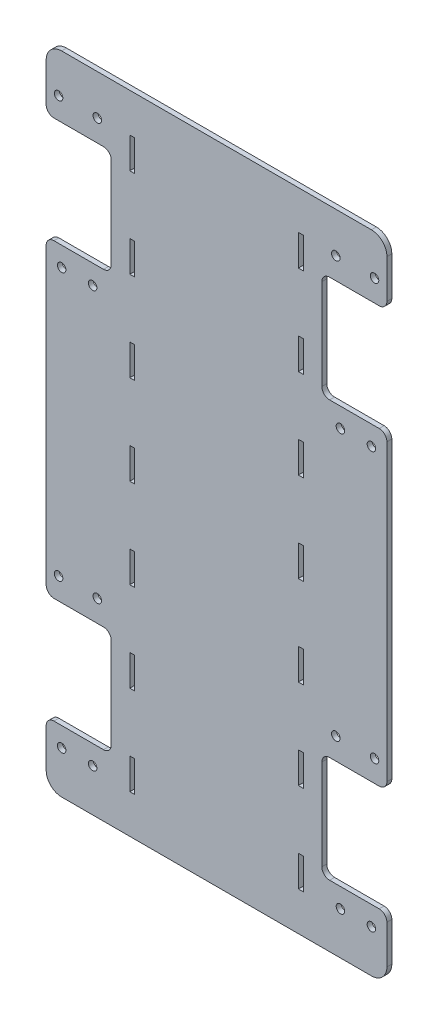
from build123d import *

# Parameters (mm, degrees)
BOSS_EXTRU_1_DEPTH      = 3.175
ESQUISSE2_W             = 3.175
ESQUISSE2_H             = 20
ENL_V_MAT_EXTRU_1_DEPTH = 236.847494422
D_GAGEMENT_M51_D        = 5.5
CONG_1_R                = 5
CONG_2_R                = 10
CUT_EXTRUDE3_DEPTH      = 1


with BuildPart() as part:
    # Esquisse1 → Boss.-Extru.1 (new body)
    with BuildSketch(Plane.XY):
        Polygon((110, 208.6), (-110, 208.6), (-110, 168.6), (-68, 168.6), (-68, 100), (-110, 100), (-110, -100), (-68, -100), (-68, -168.6), (-110, -168.6), (-110, -208.6), (110, -208.6), (110, -168.6), (68, -168.6), (68, -100), (110, -100), (110, 100), (68, 100), (68, 168.6), (110, 168.6), align=None)
    extrude(amount=BOSS_EXTRU_1_DEPTH)

    # Esquisse2 → Enlèv. mat.-Extru.1 (cut, symmetric)
    with BuildSketch(Plane.XY.offset(3.175)):
        with Locations((-54.4125, 173.6)):
            Rectangle(ESQUISSE2_W, ESQUISSE2_H)
        with Locations((-54.4125, 115.733333333)):
            Rectangle(ESQUISSE2_W, ESQUISSE2_H)
        with Locations((-54.4125, 57.866666667)):
            Rectangle(ESQUISSE2_W, ESQUISSE2_H)
        with Locations((-54.4125, 0)):
            Rectangle(ESQUISSE2_W, ESQUISSE2_H)
        with Locations((-54.4125, -57.866666667)):
            Rectangle(ESQUISSE2_W, ESQUISSE2_H)
        with Locations((-54.4125, -115.733333333)):
            Rectangle(ESQUISSE2_W, ESQUISSE2_H)
        with Locations((-54.4125, -173.6)):
            Rectangle(ESQUISSE2_W, ESQUISSE2_H)
    enl_v_mat_extru_1 = extrude(amount=ENL_V_MAT_EXTRU_1_DEPTH, both=True, mode=Mode.SUBTRACT)

    # Symétrie1: Enlèv. mat.-Extru.1 across plane
    add(enl_v_mat_extru_1.mirror(Plane(origin=(0, 0, 0), x_dir=(0, 0, 1), z_dir=(1, 0, 0))), mode=Mode.SUBTRACT)

    # Dégagement M51 (through all)
    with Locations(Plane(origin=(100, -181.1, 3.175), x_dir=(1, 0, 0), z_dir=(0, 0, 1))):
        with Locations((0, 0), (-20, 0), (-200, 0), (-180, 0), (-202, 95.1), (-177, 95.1), (-23, 95.1), (2, 95.1), (-20, 268.6), (0, 268.6), (-23, 363.7), (2, 363.7), (-200, 268.6), (-180, 268.6), (-202, 363.7), (-177, 363.7)):
            Hole(D_GAGEMENT_M51_D / 2)

    # Congé1
    cong_1_edges = [part.edges().sort_by_distance(p)[0] for p in [
        (110, 168.6, 1.5875),
        (68, 168.6, 1.5875),
        (68, 100, 1.5875),
        (110, 100, 1.5875),
        (110, -100, 1.5875),
        (68, -100, 1.5875),
        (68, -168.6, 1.5875),
        (110, -168.6, 1.5875),
        (-110, -168.6, 1.5875),
        (-68, -168.6, 1.5875),
        (-68, -100, 1.5875),
        (-110, -100, 1.5875),
        (-110, 100, 1.5875),
        (-68, 100, 1.5875),
        (-68, 168.6, 1.5875),
        (-110, 168.6, 1.5875),
    ]]
    fillet(cong_1_edges, radius=CONG_1_R)

    # Congé2
    cong_2_edges = [part.edges().sort_by_distance(p)[0] for p in [
        (110, -208.6, 1.5875),
        (-110, -208.6, 1.5875),
        (-110, 208.6, 1.5875),
        (110, 208.6, 1.5875),
    ]]
    fillet(cong_2_edges, radius=CONG_2_R)

    # Sketch1 → Cut-Extrude3 (cut)
    # profile 1 of 7: a face of its own
    with BuildSketch(Plane(origin=(0, 0, 0), x_dir=(-1, 0, 0), z_dir=(0, 0, -1))):
        with BuildLine():
            Line((-19.606236645, 107.70798945), (-29.570512821, 99.577564103))
            Line((-29.570512821, 99.577564103), (-29.570512821, 105.503128339))
            Line((-29.570512821, 105.503128339), (-22.383513622, 111.375691106))
            add(Edge.make_bspline(
                [(-22.383513622, 111.375691106), (-22.741437958, 111.964685247), (-23.450693374, 113.13182378), (-24.364884229, 114.951652708), (-25.125610264, 116.807671532), (-25.754108683, 118.695773621), (-26.257184794, 120.613208862), (-26.606340892, 122.569700381), (-26.809091491, 124.558152139), (-26.840861563, 125.894107504), (-26.856837607, 126.565912126)],
                knots=[0, 0, 0, 0, 1.030216282, 2.041455142, 3.041201647, 4.026904037, 5.014869161, 6.002481075, 6.995518502, 8, 8, 8, 8], degree=3))
            add(Edge.make_bspline(
                [(-26.856837607, 126.565912126), (-26.833612012, 127.52837984), (-26.787910954, 129.422229788), (-26.390280827, 132.203911566), (-25.772227174, 134.876104085), (-24.889976211, 137.431941876), (-23.744786627, 139.86683489), (-22.347233132, 142.188262227), (-20.699988569, 144.397037947), (-18.818989439, 146.459372934), (-16.772502188, 148.34508293), (-14.585981225, 149.9996975), (-12.295639698, 151.406561304), (-9.890074543, 152.544095909), (-7.390223158, 153.446881281), (-4.775296317, 154.062105118), (-2.060859975, 154.460332325), (-0.212659654, 154.506209076), (0.72512687, 154.529487179)],
                knots=[0, 0, 0, 0, 1.05574053, 2.077383083, 3.077194498, 4.061905691, 5.03852134, 6.024727803, 7.030589082, 8.057245348, 9.083652609, 10.080210343, 11.061793968, 12.027891381, 12.99559829, 13.972775731, 14.971375788, 16, 16, 16, 16], degree=3))
            add(Edge.make_bspline(
                [(0.72512687, 154.529487179), (1.35455223, 154.521205078), (2.608980704, 154.504699064), (4.466917702, 154.313758316), (6.294268258, 154.03006768), (8.083438598, 153.628798262), (9.841762419, 153.103503217), (11.565772048, 152.473728354), (13.251027091, 151.710673541), (14.894071096, 150.848053904), (16.480690797, 149.886002992), (17.988204619, 148.83795543), (19.402121615, 147.701624199), (20.720447925, 146.476743183), (21.95296478, 145.170191005), (23.09719064, 143.782279054), (24.153920348, 142.309980368), (25.111344404, 140.760928155), (25.968167492, 139.14837078), (26.726000878, 137.499167366), (27.349008795, 135.802150937), (27.872848738, 134.072865938), (28.275301608, 132.301440478), (28.556785829, 130.491366962), (28.749602355, 128.644205232), (28.765488325, 127.396766536), (28.773504274, 126.767317708)],
                knots=[0, 0, 0, 0, 1.030754547, 2.054267169, 3.056358621, 4.059035041, 5.05535882, 6.060771698, 7.063448118, 8.083599711, 9.099159154, 10.101167011, 11.089250986, 12.068187652, 13.04685046, 14.029613114, 15.012716649, 16.013469748, 17.010449097, 18.0025771, 18.984265202, 19.969496577, 20.960881312, 21.957255534, 22.969245453, 24, 24, 24, 24], degree=3))
            add(Edge.make_bspline(
                [(28.773504274, 126.767317708), (28.750433635, 125.804833158), (28.705121425, 123.914451908), (28.306879779, 121.139850126), (27.689136718, 118.478083782), (26.80457592, 115.930188899), (25.66068621, 113.49886608), (24.270604876, 111.17876458), (22.608937615, 108.987953219), (20.739148938, 106.927122512), (18.686612661, 105.044902744), (16.481880641, 103.410495938), (14.17301555, 102.007686369), (11.741933823, 100.868849668), (9.194696709, 99.983397745), (6.52939839, 99.364638901), (3.751028425, 98.968223005), (1.857192274, 98.922421793), (0.894731571, 98.899145299)],
                knots=[0, 0, 0, 0, 1.050621994, 2.063488829, 3.054696817, 4.03098776, 5.002868493, 5.984293541, 6.979100426, 8.000779165, 9.019604587, 10.015189519, 10.993309009, 11.965189742, 12.941480684, 13.932688673, 14.949378006, 16, 16, 16, 16], degree=3))
            add(Edge.make_bspline(
                [(0.894731571, 98.899145299), (-0.106799356, 98.924250994), (-2.076253217, 98.973619921), (-4.961943969, 99.403977936), (-7.72405264, 100.070736191), (-10.348947102, 101.046580758), (-12.848939026, 102.297746908), (-15.231395908, 103.827020809), (-17.517722271, 105.617492192), (-18.90273359, 107.003818473), (-19.606236645, 107.70798945)],
                knots=[0, 0, 0, 0, 1.045518584, 2.0559531, 3.040547655, 4.008540931, 4.974054662, 5.954823866, 6.961172636, 8, 8, 8, 8], degree=3))
        make_face()
        with BuildLine():
            add(Edge.make_bspline(
                [(-15.694728232, 110.898677885), (-15.108366615, 110.321301401), (-13.954967316, 109.185576256), (-12.063453496, 107.711995212), (-10.097263197, 106.444567686), (-8.030241435, 105.429853972), (-5.888284946, 104.622510864), (-3.6544217, 104.064725453), (-1.338821293, 103.715474222), (0.236271335, 103.67070787), (1.03253539, 103.648076923)],
                knots=[0, 0, 0, 0, 1.052210109, 2.069743939, 3.061837814, 4.040478349, 5.010453814, 5.985306305, 6.981502329, 8, 8, 8, 8], degree=3))
            add(Edge.make_bspline(
                [(1.03253539, 103.648076923), (1.545319551, 103.653990051), (2.559003472, 103.665679263), (4.059077833, 103.826405691), (5.52602111, 104.053785783), (6.957212263, 104.382962459), (8.34975164, 104.806861138), (9.701748847, 105.330413245), (11.017565539, 105.943418191), (12.289027913, 106.658048015), (13.51429314, 107.445866927), (14.678376808, 108.322806032), (15.775276571, 109.276521902), (16.823068826, 110.296595634), (17.800154713, 111.402694236), (18.706115392, 112.590850824), (19.562874862, 113.846424618), (20.336210881, 115.175628725), (21.047172672, 116.545373157), (21.662821586, 117.947643015), (22.184254157, 119.370663875), (22.607069011, 120.812232113), (22.939878147, 122.270482328), (23.167003811, 123.747971129), (23.327564731, 125.240877727), (23.339952192, 126.243942922), (23.346153846, 126.746117121)],
                knots=[0, 0, 0, 0, 1.032958288, 2.041976502, 3.037103433, 4.023477888, 4.998866292, 5.968231228, 6.943073582, 7.921783703, 8.90545537, 9.876780072, 10.85618943, 11.833110341, 12.821898168, 13.827467856, 14.842673888, 15.88323808, 16.924703457, 17.951432745, 18.967462636, 19.976958182, 20.977218729, 21.979378626, 22.98839684, 24, 24, 24, 24], degree=3))
            add(Edge.make_bspline(
                [(23.346153846, 126.746117121), (23.339908269, 127.251815135), (23.327433157, 128.2619122), (23.167899565, 129.762030582), (22.939599638, 131.242894225), (22.608579343, 132.698085747), (22.184437168, 134.132399982), (21.662881314, 135.53969317), (21.056780111, 136.930340545), (20.350186965, 138.28360663), (19.565833061, 139.595063673), (18.724640292, 140.850013406), (17.795656146, 142.016219028), (16.809454386, 143.111847506), (15.75307657, 144.134067587), (14.634481577, 145.088337015), (13.440440572, 145.957729113), (12.192383725, 146.754264793), (10.888936973, 147.45827846), (9.553622452, 148.093210097), (8.171717197, 148.608915467), (6.754282285, 149.032298679), (5.304841473, 149.37826684), (3.814980836, 149.601256749), (2.294000995, 149.763188799), (1.266190679, 149.774722066), (0.746327457, 149.780555556)],
                knots=[0, 0, 0, 0, 1.013232303, 2.023861962, 3.020621903, 4.015492728, 5.012755829, 6.016661994, 7.022041205, 8.051604144, 9.07437186, 10.084107639, 11.077439333, 12.060337995, 13.03706716, 14.02195431, 15.005108131, 15.995405045, 16.987448092, 17.972869919, 18.956865295, 19.940554735, 20.937012659, 21.9407689, 22.958447392, 24, 24, 24, 24], degree=3))
            add(Edge.make_bspline(
                [(0.746327457, 149.780555556), (-0.017943884, 149.760593493), (-1.521502047, 149.72132194), (-3.729680753, 149.398900793), (-5.839797033, 148.850800592), (-7.870341496, 148.11099657), (-9.804515121, 147.137986904), (-11.652620468, 145.95637921), (-13.390699994, 144.541644662), (-15.036059206, 142.954998315), (-16.52646405, 141.209105685), (-17.838242092, 139.358435864), (-18.951154527, 137.418614274), (-19.849408505, 135.383595435), (-20.570735836, 133.2685425), (-21.059089092, 131.056762524), (-21.382782692, 128.762713114), (-21.413773156, 127.199533489), (-21.429487179, 126.406907719)],
                knots=[0, 0, 0, 0, 1.022497099, 2.011568113, 2.978414599, 3.935907004, 4.898116866, 5.870095606, 6.865600239, 7.892254889, 8.925238965, 9.932855416, 10.924083129, 11.912667955, 12.905586126, 13.909344924, 14.939912558, 16, 16, 16, 16], degree=3))
            add(Edge.make_bspline(
                [(-21.429487179, 126.406907719), (-21.423584657, 125.862336595), (-21.411909884, 124.785213371), (-21.251510962, 123.19700036), (-21.028424942, 121.650584389), (-20.680640453, 120.155717789), (-20.260855885, 118.698101629), (-19.740335461, 117.288248217), (-19.126783826, 115.922500548), (-18.641035826, 115.054181631), (-18.397803152, 114.61938101)],
                knots=[0, 0, 0, 0, 1.060709028, 2.098007545, 3.107816471, 4.10334608, 5.086030226, 6.061961114, 7.029549518, 8, 8, 8, 8], degree=3))
            Line((-18.397803152, 114.61938101), (-3.790598291, 126.534111245))
            Line((-3.790598291, 126.534111245), (-3.790598291, 120.608547009))
            Line((-3.790598291, 120.608547009), (-15.694728232, 110.898677885))
        make_face(mode=Mode.SUBTRACT)
    # profile 2 of 7: a face of its own
    with BuildSketch(Plane(origin=(0, 0, 0), x_dir=(-1, 0, 0), z_dir=(0, 0, -1))):
        with BuildLine():
            Line((13.169871795, 90.079700855), (13.169871795, 85.330769231))
            Line((13.169871795, 85.330769231), (-4.765825321, 85.330769231))
            add(Edge.make_bspline(
                [(-4.765825321, 85.330769231), (-5.292312124, 85.328623764), (-6.299456717, 85.324519586), (-7.74869585, 85.296686312), (-9.070353291, 85.231219421), (-10.265192525, 85.14936755), (-11.333011422, 85.044106683), (-12.270080272, 84.918870161), (-13.087025674, 84.778891643), (-13.579050219, 84.641872039), (-13.807875935, 84.578148371)],
                knots=[0, 0, 0, 0, 1.388932606, 2.656963016, 3.823490214, 4.879454478, 5.816252168, 6.653371382, 7.373723809, 8, 8, 8, 8], degree=3))
            add(Edge.make_bspline(
                [(-13.807875935, 84.578148371), (-14.095482826, 84.47592094), (-14.664717331, 84.273591362), (-15.487038935, 83.906609153), (-16.24862191, 83.452573038), (-16.979094287, 82.955898353), (-17.655849895, 82.382386603), (-18.283308853, 81.74042354), (-18.868790686, 81.041403877), (-19.574928593, 80.017478477), (-20.322218338, 78.617759747), (-20.976003413, 76.784172197), (-21.360985717, 74.792426399), (-21.406231333, 73.414210242), (-21.429487179, 72.705819311)],
                knots=[0, 0, 0, 0, 0.725930277, 1.436768641, 2.137297926, 2.832005607, 3.535753883, 4.242956221, 4.964984144, 5.701683124, 7.198126434, 8.723945959, 10.316137162, 12, 12, 12, 12], degree=3))
            add(Edge.make_bspline(
                [(-21.429487179, 72.705819311), (-21.406318194, 71.997338614), (-21.361604083, 70.630032978), (-20.981815911, 68.659098008), (-20.362222817, 66.854108717), (-19.485211954, 65.236139991), (-18.416021803, 63.815348777), (-17.160915325, 62.631490401), (-15.760168487, 61.654682594), (-14.715072061, 61.228184043), (-14.189486512, 61.013695246)],
                knots=[0, 0, 0, 0, 1.157091467, 2.233085092, 3.266839029, 4.264239195, 5.228693433, 6.160074799, 7.074690074, 8, 8, 8, 8], degree=3))
            add(Edge.make_bspline(
                [(-14.189486512, 61.013695246), (-13.978333863, 60.950235575), (-13.511526927, 60.80994174), (-12.719502714, 60.660285585), (-11.775903732, 60.519892952), (-10.670820522, 60.426294581), (-9.413998115, 60.319470074), (-7.998936972, 60.282583297), (-6.433977964, 60.229907065), (-5.338307108, 60.229490932), (-4.765825321, 60.229273504)],
                knots=[0, 0, 0, 0, 0.557560243, 1.232629526, 2.036798082, 2.970922211, 4.03790722, 5.227863888, 6.551574656, 8, 8, 8, 8], degree=3))
            Line((-4.765825321, 60.229273504), (13.169871795, 60.229273504))
            Line((13.169871795, 60.229273504), (13.169871795, 55.48034188))
            Line((13.169871795, 55.48034188), (-5.65625, 55.48034188))
            add(Edge.make_bspline(
                [(-5.65625, 55.48034188), (-6.295894152, 55.487019869), (-7.536891304, 55.499976081), (-9.340353302, 55.58324209), (-11.021021142, 55.726110476), (-12.579781261, 55.942960748), (-14.015454317, 56.197945171), (-15.329844601, 56.52690751), (-16.519021334, 56.919579625), (-17.603452077, 57.36296743), (-18.587720281, 57.88531928), (-19.516352743, 58.445015563), (-20.387803526, 59.073159447), (-21.206356021, 59.764187764), (-21.969041216, 60.514996874), (-22.672534204, 61.330602878), (-23.329284663, 62.19464606), (-23.926442763, 63.122189561), (-24.458750796, 64.114180632), (-24.922854331, 65.165628247), (-25.306253051, 66.284202359), (-25.619751546, 67.457372551), (-25.879341635, 68.694956222), (-26.053347217, 69.991617119), (-26.164112065, 71.350565141), (-26.173569812, 72.274512326), (-26.178418803, 72.748220486)],
                knots=[0, 0, 0, 0, 1.492959813, 2.896546261, 4.212934643, 5.4282803, 6.568701279, 7.614836728, 8.587629399, 9.489753423, 10.345563548, 11.185732697, 12.018869657, 12.849922188, 13.68387515, 14.5140269, 15.361852057, 16.215154979, 17.085973896, 17.987004002, 18.894652782, 19.842944701, 20.819888734, 21.843945232, 22.894589698, 24, 24, 24, 24], degree=3))
            add(Edge.make_bspline(
                [(-26.178418803, 72.748220486), (-26.173282755, 73.218370164), (-26.163189942, 74.142258047), (-26.055212611, 75.498001859), (-25.876684316, 76.797462931), (-25.621849482, 78.036021337), (-25.303758782, 79.214919963), (-24.925729139, 80.338934066), (-24.455821855, 81.394902221), (-23.926994498, 82.395511091), (-23.328805215, 83.332928151), (-22.673121759, 84.21147451), (-21.960922948, 85.029972161), (-21.195183143, 85.788601642), (-20.366403272, 86.476714502), (-19.481250158, 87.102885609), (-18.548494295, 87.676754841), (-17.549682196, 88.196136315), (-16.452462524, 88.642325952), (-15.23844689, 89.036256455), (-13.894325505, 89.358453012), (-12.421247539, 89.620654617), (-10.826262981, 89.831587112), (-9.100145274, 89.978032357), (-7.247098976, 90.05991456), (-5.967273257, 90.072963227), (-5.306440304, 90.079700855)],
                knots=[0, 0, 0, 0, 1.083640291, 2.129454052, 3.13281866, 4.105697902, 5.042300162, 5.946461698, 6.836384745, 7.703652036, 8.553297018, 9.397182691, 10.228592656, 11.052265423, 11.879314572, 12.708807002, 13.549817954, 14.402308542, 15.300838682, 16.27712199, 17.341985831, 18.484375296, 19.725102775, 21.0496083, 22.476576903, 24, 24, 24, 24], degree=3))
            Line((-5.306440304, 90.079700855), (13.169871795, 90.079700855))
        make_face()
    # profile 3 of 7: a face of its own
    with BuildSketch(Plane(origin=(0, 0, 0), x_dir=(-1, 0, 0), z_dir=(0, 0, -1))):
        with BuildLine():
            Line((13.169871795, 5.277350427), (-25.5, 5.277350427))
            Line((-25.5, 5.277350427), (-25.5, 10.026282051))
            Line((-25.5, 10.026282051), (-18.81121461, 10.026282051))
            add(Edge.make_bspline(
                [(-18.81121461, 10.026282051), (-19.416738531, 10.561668457), (-20.598426076, 11.606481761), (-22.137602021, 13.351219643), (-23.420319472, 15.192948205), (-24.446703526, 17.137895335), (-25.22355616, 19.180241803), (-25.769861453, 21.314163354), (-26.125491281, 23.536815994), (-26.160618014, 25.052588452), (-26.178418803, 25.820719818)],
                knots=[0, 0, 0, 0, 1.074295371, 2.096500925, 3.086030275, 4.053105238, 5.014108356, 5.985331429, 6.979048527, 8, 8, 8, 8], degree=3))
            add(Edge.make_bspline(
                [(-26.178418803, 25.820719818), (-26.1598803, 26.503618119), (-26.123321549, 27.850323805), (-25.839609144, 29.831331977), (-25.384226207, 31.737825233), (-24.750123379, 33.571018617), (-23.913347882, 35.318490744), (-22.900733953, 36.990088153), (-21.706683258, 38.589712058), (-20.336313406, 40.086940957), (-18.84947111, 41.467423104), (-17.259001134, 42.675205553), (-15.586748546, 43.698840501), (-13.833183344, 44.540085098), (-11.999587384, 45.191084277), (-10.087218549, 45.64400356), (-8.099258921, 45.927410231), (-6.745500833, 45.96395046), (-6.059061165, 45.982478632)],
                knots=[0, 0, 0, 0, 1.034036272, 2.039165313, 3.024406509, 3.999331371, 4.971254918, 5.953351348, 6.95522652, 7.989525907, 9.023492927, 10.024309745, 11.009187477, 11.988246066, 12.964946762, 13.950187958, 14.960617622, 16, 16, 16, 16], degree=3))
            add(Edge.make_bspline(
                [(-6.059061165, 45.982478632), (-5.386809447, 45.963539513), (-4.057804068, 45.926097895), (-2.103274686, 45.647036102), (-0.220524301, 45.178122985), (1.583472681, 44.518809003), (3.315981549, 43.677117061), (4.963447127, 42.635877906), (6.551070999, 41.428530683), (8.027940882, 40.033294674), (9.387192754, 38.522627597), (10.584145227, 36.914053955), (11.594162903, 35.227631054), (12.415209081, 33.459977374), (13.067662356, 31.623609468), (13.522485112, 29.704577431), (13.789848085, 27.711608245), (13.828622577, 26.358611453), (13.848290598, 25.672315705)],
                knots=[0, 0, 0, 0, 1.02050356, 2.017480486, 2.990790918, 3.96161403, 4.928589988, 5.909588639, 6.91611943, 7.952353252, 8.989586576, 9.99823133, 10.991940466, 11.968822692, 12.952985106, 13.945868367, 14.958059758, 16, 16, 16, 16], degree=3))
            add(Edge.make_bspline(
                [(13.848290598, 25.672315705), (13.826659006, 24.883072829), (13.784240475, 23.335404799), (13.427479052, 21.068721103), (12.832165074, 18.922448926), (12.013986039, 16.884216871), (10.93480109, 14.961931733), (9.561165974, 13.17925172), (7.924461364, 11.500288605), (6.663646698, 10.527170546), (6.014673478, 10.026282051)],
                knots=[0, 0, 0, 0, 1.03879612, 2.037030165, 3.012306674, 3.966139504, 4.922386257, 5.905048148, 6.921675258, 8, 8, 8, 8], degree=3))
            Line((6.014673478, 10.026282051), (13.169871795, 10.026282051))
            Line((13.169871795, 10.026282051), (13.169871795, 5.277350427))
        make_face()
        with BuildLine():
            add(Edge.make_bspline(
                [(9.099358974, 25.608713942), (9.074660194, 26.302895421), (9.025908729, 27.673099245), (8.645305612, 29.684591805), (8.012064881, 31.609472081), (7.145962755, 33.437976133), (6.057158344, 35.141728969), (4.739220792, 36.662950034), (3.234060955, 38.019839155), (1.529024229, 39.141691681), (-0.278012654, 40.087524967), (-2.181318959, 40.736131772), (-4.128091421, 41.167735795), (-5.449016965, 41.211552818), (-6.112062634, 41.233547009)],
                knots=[0, 0, 0, 0, 1.031093775, 2.03521511, 3.029845951, 4.035119871, 5.034286494, 6.024708811, 7.017619509, 8.03559408, 9.050082311, 10.039808432, 11.016071318, 12, 12, 12, 12], degree=3))
            add(Edge.make_bspline(
                [(-6.112062634, 41.233547009), (-6.771015299, 41.205091685), (-8.086337759, 41.148292574), (-10.038894349, 40.747508543), (-11.934538453, 40.053085689), (-13.766606756, 39.128841146), (-15.475143277, 37.9818246), (-17.009736346, 36.636196773), (-18.332959387, 35.095577359), (-19.440497485, 33.388128941), (-20.332012998, 31.567263787), (-20.960659248, 29.651504446), (-21.357615509, 27.674511406), (-21.40544937, 26.327849276), (-21.429487179, 25.651115118)],
                knots=[0, 0, 0, 0, 0.979154363, 1.954470772, 2.947816011, 3.971783346, 4.997163654, 5.998045606, 6.995988793, 8.00538986, 9.015323546, 10.000094788, 10.994993517, 12, 12, 12, 12], degree=3))
            add(Edge.make_bspline(
                [(-21.429487179, 25.651115118), (-21.404765964, 24.963925635), (-21.355722966, 23.600649957), (-20.968754697, 21.584423049), (-20.343387475, 19.624768699), (-19.464889007, 17.75083739), (-18.381118975, 16.006425097), (-17.106751051, 14.442781323), (-15.637087489, 13.107606104), (-14.008927343, 11.988308942), (-12.232364779, 11.104120286), (-10.332810711, 10.480490587), (-8.32519289, 10.097465439), (-6.951207122, 10.050337932), (-6.249866453, 10.026282051)],
                knots=[0, 0, 0, 0, 1.017484689, 2.018529338, 3.030031036, 4.058138743, 5.076350332, 6.065651025, 7.036469986, 8.00785331, 8.984076697, 9.96571663, 10.961615403, 12, 12, 12, 12], degree=3))
            add(Edge.make_bspline(
                [(-6.249866453, 10.026282051), (-5.715592317, 10.040791371), (-4.663971742, 10.069350304), (-3.119897995, 10.287523495), (-1.642267922, 10.634592115), (-0.229464206, 11.123591746), (1.11046687, 11.766181815), (2.388028505, 12.540387499), (3.591320381, 13.46208891), (4.718818642, 14.503236323), (5.742065865, 15.655716425), (6.643947382, 16.881229649), (7.407187313, 18.176692616), (8.017978893, 19.541195984), (8.51557548, 20.96423025), (8.844229424, 22.459434931), (9.070621269, 24.011741099), (9.08967888, 25.070784843), (9.099358974, 25.608713942)],
                knots=[0, 0, 0, 0, 1.050062701, 2.066855696, 3.059271411, 4.030305351, 4.999747758, 5.975466543, 6.961907836, 7.974539719, 8.98812422, 9.98710676, 10.961662635, 11.93785114, 12.922015094, 13.919620009, 14.94329489, 16, 16, 16, 16], degree=3))
        make_face(mode=Mode.SUBTRACT)
    # profile 4 of 7: a face of its own
    with BuildSketch(Plane(origin=(0, 0, 0), x_dir=(-1, 0, 0), z_dir=(0, 0, -1))):
        with BuildLine():
            Line((28.773504274, -44.925641026), (-25.5, -44.925641026))
            Line((-25.5, -44.925641026), (-25.5, -40.176709402))
            Line((-25.5, -40.176709402), (-18.81121461, -40.176709402))
            add(Edge.make_bspline(
                [(-18.81121461, -40.176709402), (-19.416738531, -39.641322996), (-20.598426076, -38.596509692), (-22.137602021, -36.85177181), (-23.420319472, -35.010043248), (-24.446703526, -33.065096118), (-25.22355616, -31.02274965), (-25.769861453, -28.888828099), (-26.125491281, -26.666175459), (-26.160618014, -25.150403001), (-26.178418803, -24.382271635)],
                knots=[0, 0, 0, 0, 1.074295371, 2.096500925, 3.086030275, 4.053105238, 5.014108356, 5.985331429, 6.979048527, 8, 8, 8, 8], degree=3))
            add(Edge.make_bspline(
                [(-26.178418803, -24.382271635), (-26.1598803, -23.699373334), (-26.123321549, -22.352667648), (-25.839609144, -20.371659476), (-25.384226207, -18.46516622), (-24.750123379, -16.631972836), (-23.913347882, -14.884500709), (-22.900733953, -13.2129033), (-21.706683258, -11.613279395), (-20.336313406, -10.116050496), (-18.84947111, -8.735568349), (-17.259001134, -7.5277859), (-15.586748546, -6.504150952), (-13.833183344, -5.662906355), (-11.999587384, -5.011907176), (-10.087218549, -4.558987893), (-8.099258921, -4.275581222), (-6.745500833, -4.239040993), (-6.059061165, -4.220512821)],
                knots=[0, 0, 0, 0, 1.034036272, 2.039165313, 3.024406509, 3.999331371, 4.971254918, 5.953351348, 6.95522652, 7.989525907, 9.023492927, 10.024309745, 11.009187477, 11.988246066, 12.964946762, 13.950187958, 14.960617622, 16, 16, 16, 16], degree=3))
            add(Edge.make_bspline(
                [(-6.059061165, -4.220512821), (-5.386809447, -4.23945194), (-4.057804068, -4.276893558), (-2.103274686, -4.555955351), (-0.220524301, -5.024868468), (1.583472681, -5.68418245), (3.315981549, -6.525874392), (4.963447127, -7.567113547), (6.551070999, -8.77446077), (8.027940882, -10.169696779), (9.387192754, -11.680363856), (10.584145227, -13.288937498), (11.594162903, -14.975360399), (12.415209081, -16.743014079), (13.067662356, -18.579381985), (13.522485112, -20.498414022), (13.789848085, -22.491383208), (13.828622577, -23.84438), (13.848290598, -24.530675748)],
                knots=[0, 0, 0, 0, 1.02050356, 2.017480486, 2.990790918, 3.96161403, 4.928589988, 5.909588639, 6.91611943, 7.952353252, 8.989586576, 9.99823133, 10.991940466, 11.968822692, 12.952985106, 13.945868367, 14.958059758, 16, 16, 16, 16], degree=3))
            add(Edge.make_bspline(
                [(13.848290598, -24.530675748), (13.824709822, -25.320179362), (13.778423379, -26.869887219), (13.387598647, -29.139054837), (12.739288527, -31.287680209), (11.842696647, -33.323338323), (10.685720149, -35.233928914), (9.276119187, -37.027298334), (7.597323965, -38.690027171), (6.332864109, -39.673593194), (5.68606437, -40.176709402)],
                knots=[0, 0, 0, 0, 1.030970925, 2.023681352, 2.997808474, 3.956843046, 4.921958419, 5.908293655, 6.930045022, 8, 8, 8, 8], degree=3))
            Line((5.68606437, -40.176709402), (28.773504274, -40.176709402))
            Line((28.773504274, -40.176709402), (28.773504274, -44.925641026))
        make_face()
        with BuildLine():
            add(Edge.make_bspline(
                [(9.099358974, -24.594277511), (9.074660194, -23.900096032), (9.025908729, -22.529892208), (8.645305612, -20.518399648), (8.012064881, -18.593519372), (7.145962755, -16.76501532), (6.057158344, -15.061262484), (4.739220792, -13.540041419), (3.234060955, -12.183152298), (1.529024229, -11.061299772), (-0.278012654, -10.115466486), (-2.181318959, -9.466859681), (-4.128091421, -9.035255658), (-5.449016965, -8.991438635), (-6.112062634, -8.969444444)],
                knots=[0, 0, 0, 0, 1.031093775, 2.03521511, 3.029845951, 4.035119871, 5.034286494, 6.024708811, 7.017619509, 8.03559408, 9.050082311, 10.039808432, 11.016071318, 12, 12, 12, 12], degree=3))
            add(Edge.make_bspline(
                [(-6.112062634, -8.969444444), (-6.771015299, -8.997899768), (-8.086337759, -9.054698879), (-10.038894349, -9.45548291), (-11.934538453, -10.149905764), (-13.766606756, -11.074150307), (-15.475143277, -12.221166853), (-17.009736346, -13.56679468), (-18.332959387, -15.107414094), (-19.440497485, -16.814862512), (-20.332012998, -18.635727666), (-20.960659248, -20.551487006), (-21.357615509, -22.528480047), (-21.40544937, -23.875142177), (-21.429487179, -24.551876335)],
                knots=[0, 0, 0, 0, 0.979154363, 1.954470772, 2.947816011, 3.971783346, 4.997163654, 5.998045606, 6.995988793, 8.00538986, 9.015323546, 10.000094788, 10.994993517, 12, 12, 12, 12], degree=3))
            add(Edge.make_bspline(
                [(-21.429487179, -24.551876335), (-21.404765964, -25.239065818), (-21.355722966, -26.602341496), (-20.968754697, -28.618568404), (-20.343387475, -30.578222754), (-19.464889007, -32.452154063), (-18.381118975, -34.196566356), (-17.106751051, -35.76021013), (-15.637087489, -37.095385349), (-14.008927343, -38.214682511), (-12.232364779, -39.098871167), (-10.332810711, -39.722500866), (-8.32519289, -40.105526014), (-6.951207122, -40.152653521), (-6.249866453, -40.176709402)],
                knots=[0, 0, 0, 0, 1.017484689, 2.018529338, 3.030031036, 4.058138743, 5.076350332, 6.065651025, 7.036469986, 8.00785331, 8.984076697, 9.96571663, 10.961615403, 12, 12, 12, 12], degree=3))
            add(Edge.make_bspline(
                [(-6.249866453, -40.176709402), (-5.715592317, -40.162200082), (-4.663971742, -40.133641149), (-3.119897995, -39.915467958), (-1.642267922, -39.568399338), (-0.229464206, -39.079399707), (1.11046687, -38.436809638), (2.388028505, -37.662603954), (3.591320381, -36.740902543), (4.718818642, -35.69975513), (5.742065865, -34.547275028), (6.643947382, -33.321761804), (7.407187313, -32.026298837), (8.017978893, -30.661795469), (8.51557548, -29.238761203), (8.844229424, -27.743556522), (9.070621269, -26.191250354), (9.08967888, -25.13220661), (9.099358974, -24.594277511)],
                knots=[0, 0, 0, 0, 1.050062701, 2.066855696, 3.059271411, 4.030305351, 4.999747758, 5.975466543, 6.961907836, 7.974539719, 8.98812422, 9.98710676, 10.961662635, 11.93785114, 12.922015094, 13.919620009, 14.94329489, 16, 16, 16, 16], degree=3))
        make_face(mode=Mode.SUBTRACT)
    # profile 5 of 7: a face of its own
    with BuildSketch(Plane(origin=(0, 0, 0), x_dir=(-1, 0, 0), z_dir=(0, 0, -1))):
        with BuildLine():
            Line((13.169871795, -54.423504274), (13.169871795, -59.172435897))
            Line((13.169871795, -59.172435897), (7.477514022, -59.172435897))
            add(Edge.make_bspline(
                [(7.477514022, -59.172435897), (8.007580212, -59.522985725), (9.021327682, -60.193409547), (10.361203581, -61.308425339), (11.475531829, -62.450193773), (12.353431428, -63.63291419), (13.016285537, -64.846699495), (13.505884047, -66.071366257), (13.790475466, -67.332283848), (13.828993072, -68.18132382), (13.848290598, -68.606697382)],
                knots=[0, 0, 0, 0, 1.280622107, 2.44917983, 3.507334186, 4.490567186, 5.408878616, 6.288712897, 7.142636019, 8, 8, 8, 8], degree=3))
            add(Edge.make_bspline(
                [(13.848290598, -68.606697382), (13.830693645, -68.936797572), (13.794670049, -69.612562066), (13.528901397, -70.638633089), (13.120687535, -71.700159765), (12.727418188, -72.385184125), (12.523253873, -72.740811966)],
                knots=[0, 0, 0, 0, 0.90119973, 1.844890732, 2.881183062, 4, 4, 4, 4], degree=3))
            Line((12.523253873, -72.740811966), (8.410339877, -70.13313969))
            add(Edge.make_bspline(
                [(8.410339877, -70.13313969), (8.512246281, -69.90470568), (8.705684145, -69.471094198), (8.934616918, -68.836781113), (9.069417074, -68.251956141), (9.089838635, -67.879369009), (9.099358974, -67.705672409)],
                knots=[0, 0, 0, 0, 1.180555205, 2.24091978, 3.179933427, 4, 4, 4, 4], degree=3))
            add(Edge.make_bspline(
                [(9.099358974, -67.705672409), (9.074892356, -67.320756276), (9.025433292, -66.542651539), (8.608899429, -65.401915629), (7.964218027, -64.289972143), (7.223795058, -63.418132867), (6.523482853, -62.737909052), (5.908590422, -62.252226363), (5.219578065, -61.806405041), (4.467685487, -61.380518597), (3.640230253, -60.992462702), (2.745434142, -60.630292644), (1.782273921, -60.302830771), (1.111252392, -60.11610691), (0.767528045, -60.020459402)],
                knots=[0, 0, 0, 0, 1.135927944, 2.296268816, 3.551388088, 4.924624343, 5.663947748, 6.437790805, 7.238014523, 8.089896346, 8.992356783, 9.939655789, 10.944608424, 12, 12, 12, 12], degree=3))
            add(Edge.make_bspline(
                [(0.767528045, -60.020459402), (0.460956492, -59.948910121), (-0.218076202, -59.790433901), (-1.357274135, -59.636347555), (-2.703227071, -59.484106034), (-4.259681511, -59.376811923), (-6.022750604, -59.277358191), (-7.995120258, -59.221265281), (-10.178814972, -59.174348751), (-11.705451026, -59.173092859), (-12.504039797, -59.172435897)],
                knots=[0, 0, 0, 0, 0.566838948, 1.255505196, 2.06880316, 3.007127437, 4.065329342, 5.249902469, 6.561414163, 8, 8, 8, 8], degree=3))
            Line((-12.504039797, -59.172435897), (-25.5, -59.172435897))
            Line((-25.5, -59.172435897), (-25.5, -54.423504274))
            Line((-25.5, -54.423504274), (13.169871795, -54.423504274))
        make_face()
    # profile 6 of 7: a face of its own
    with BuildSketch(Plane(origin=(0, 0, 0), x_dir=(-1, 0, 0), z_dir=(0, 0, -1))):
        with BuildLine():
            Line((27.416666667, -79.525), (27.416666667, -84.273931624))
            Line((27.416666667, -84.273931624), (-4.288812099, -84.273931624))
            add(Edge.make_bspline(
                [(-4.288812099, -84.273931624), (-4.737556556, -84.2732249), (-5.589126496, -84.271883768), (-6.801194849, -84.280842014), (-7.878766551, -84.305930084), (-8.825995259, -84.32174702), (-9.638534417, -84.356934087), (-10.320786138, -84.385630748), (-10.869519913, -84.422529641), (-11.189755343, -84.466875584), (-11.327407185, -84.4859375)],
                knots=[0, 0, 0, 0, 1.528628734, 2.90083645, 4.128790002, 5.200304208, 6.127813768, 6.898992206, 7.526736466, 8, 8, 8, 8], degree=3))
            add(Edge.make_bspline(
                [(-11.327407185, -84.4859375), (-11.824061975, -84.564139764), (-12.789386836, -84.716137874), (-14.163245057, -85.104926169), (-15.405669582, -85.643530405), (-16.541439025, -86.299311046), (-17.553668073, -87.14266058), (-18.493427162, -88.146414213), (-19.305312516, -89.373874916), (-20.05224302, -90.737846661), (-20.651720231, -92.208897041), (-21.105248689, -93.711851352), (-21.381593663, -95.224418468), (-21.413595627, -96.237032652), (-21.429487179, -96.739877137)],
                knots=[0, 0, 0, 0, 1.035924841, 2.013479024, 2.933602255, 3.82183108, 4.706948133, 5.639927629, 6.646101806, 7.731477349, 8.84205456, 9.913728764, 10.963998332, 12, 12, 12, 12], degree=3))
            add(Edge.make_bspline(
                [(-21.429487179, -96.739877137), (-21.413252483, -97.171583281), (-21.380876858, -98.032502147), (-21.180363287, -99.311659139), (-20.819060515, -100.55751483), (-20.352599141, -101.775951392), (-19.737251507, -102.918836179), (-19.021500473, -103.985351281), (-18.194196063, -104.947397366), (-17.265582497, -105.814982989), (-16.227393188, -106.57459487), (-15.082756178, -107.215510829), (-13.835434237, -107.755680142), (-12.955892893, -108.020398102), (-12.504039797, -108.156393563)],
                knots=[0, 0, 0, 0, 0.994510594, 1.983277156, 2.972612928, 3.9776239, 4.982470102, 5.955333794, 6.930747147, 7.898149105, 8.876444039, 9.885893618, 10.913904934, 12, 12, 12, 12], degree=3))
            add(Edge.make_bspline(
                [(-12.504039797, -108.156393563), (-12.317341113, -108.2017526), (-11.901301207, -108.302830815), (-11.1979436, -108.397280185), (-10.368068693, -108.495652653), (-9.405713904, -108.563908652), (-8.314103961, -108.630450913), (-7.087552211, -108.670260466), (-5.730512446, -108.688660844), (-4.783498215, -108.694144226), (-4.288812099, -108.697008547)],
                knots=[0, 0, 0, 0, 0.558680831, 1.244966039, 2.062412453, 2.990489873, 4.051219941, 5.244515665, 6.560634259, 8, 8, 8, 8], degree=3))
            Line((-4.288812099, -108.697008547), (27.416666667, -108.697008547))
            Line((27.416666667, -108.697008547), (27.416666667, -113.445940171))
            Line((27.416666667, -113.445940171), (-4.543219151, -113.445940171))
            add(Edge.make_bspline(
                [(-4.543219151, -113.445940171), (-5.119236554, -113.442140558), (-6.243369538, -113.434725384), (-7.890524227, -113.369115113), (-9.453427026, -113.26752688), (-10.930083762, -113.113947508), (-12.322252919, -112.944401408), (-13.627900551, -112.701815251), (-14.855781339, -112.44821855), (-16.003792987, -112.127447887), (-17.087124851, -111.740492689), (-18.134350722, -111.28744149), (-19.136909913, -110.733068979), (-20.109282014, -110.100454148), (-21.052799149, -109.39807888), (-21.945303705, -108.588505604), (-22.816056444, -107.713648497), (-23.636323947, -106.755079011), (-24.393927978, -105.729927864), (-25.045618972, -104.636374047), (-25.617840986, -103.496437412), (-26.069841079, -102.297908276), (-26.419691071, -101.0485932), (-26.677156076, -99.748556749), (-26.824037184, -98.393377967), (-26.845811442, -97.471639363), (-26.856837607, -97.004884482)],
                knots=[0, 0, 0, 0, 1.316364231, 2.568964831, 3.766826305, 4.894964518, 5.961692026, 6.970710131, 7.928946231, 8.826316495, 9.692177228, 10.556379512, 11.43093279, 12.306715499, 13.20629939, 14.115652445, 15.057829886, 16.025681089, 16.996391533, 17.967202739, 18.931442607, 19.907779629, 20.889445314, 21.893507297, 22.933303057, 24, 24, 24, 24], degree=3))
            add(Edge.make_bspline(
                [(-26.856837607, -97.004884482), (-26.844972703, -96.495839716), (-26.821693805, -95.497095707), (-26.688302226, -94.025436833), (-26.437047931, -92.614615055), (-26.117129734, -91.249729772), (-25.675899421, -89.949363208), (-25.160368247, -88.696093275), (-24.527223955, -87.511384644), (-23.822776227, -86.376017818), (-23.030165626, -85.320334005), (-22.166260615, -84.351242315), (-21.244900147, -83.467142843), (-20.256108903, -82.682937553), (-19.207577142, -81.985633703), (-18.096338636, -81.384950714), (-16.922823618, -80.869190952), (-16.107102612, -80.602996426), (-15.694728232, -80.468426149)],
                knots=[0, 0, 0, 0, 1.13879206, 2.234305948, 3.301075583, 4.341971843, 5.366689343, 6.369221514, 7.369726634, 8.367512178, 9.355451585, 10.318319045, 11.268648973, 12.207971039, 13.137398894, 14.081662264, 15.030215811, 16, 16, 16, 16], degree=3))
            add(Edge.make_bspline(
                [(-15.694728232, -80.468426149), (-15.413021451, -80.390152448), (-14.801993171, -80.220375047), (-13.790733166, -80.038563999), (-12.626340958, -79.885724313), (-11.308736847, -79.742009325), (-9.836899578, -79.657207223), (-8.21146716, -79.582860233), (-6.430474168, -79.524476234), (-5.189888039, -79.524820531), (-4.543219151, -79.525)],
                knots=[0, 0, 0, 0, 0.625038921, 1.35572334, 2.194682327, 3.136881307, 4.189498639, 5.346923369, 6.617055217, 8, 8, 8, 8], degree=3))
            Line((-4.543219151, -79.525), (27.416666667, -79.525))
        make_face()
    # profile 7 of 7: a face of its own
    with BuildSketch(Plane(origin=(0, 0, 0), x_dir=(-1, 0, 0), z_dir=(0, 0, -1))):
        with BuildLine():
            Line((-15.291917067, -122.265384615), (-12.610042735, -126.7387086))
            add(Edge.make_bspline(
                [(-12.610042735, -126.7387086), (-13.306492365, -127.15475814), (-14.640862978, -127.951893002), (-16.443930971, -129.281633789), (-17.976430245, -130.659476612), (-19.229445621, -132.09562487), (-20.215946647, -133.581312419), (-20.914480389, -135.126237993), (-21.350150492, -136.725195369), (-21.403068468, -137.813371004), (-21.429487179, -138.356630609)],
                knots=[0, 0, 0, 0, 1.272034388, 2.437168799, 3.508375237, 4.49857839, 5.41946034, 6.295179144, 7.148887113, 8, 8, 8, 8], degree=3))
            add(Edge.make_bspline(
                [(-21.429487179, -138.356630609), (-21.416565361, -138.820586762), (-21.390947826, -139.740380926), (-21.144797368, -141.094476041), (-20.766638695, -142.409560699), (-20.225056976, -143.658514718), (-19.569832444, -144.824162775), (-18.778365579, -145.846185838), (-17.892446432, -146.730281759), (-16.903374276, -147.451486715), (-15.843333806, -148.011362799), (-14.745519187, -148.416504622), (-13.614759351, -148.674353026), (-12.848138314, -148.707171956), (-12.461638622, -148.723717949)],
                knots=[0, 0, 0, 0, 1.095270387, 2.171376115, 3.241375676, 4.322296363, 5.380636668, 6.392615365, 7.366724986, 8.328592944, 9.273498763, 10.190095884, 11.087518669, 12, 12, 12, 12], degree=3))
            add(Edge.make_bspline(
                [(-12.461638622, -148.723717949), (-12.021056727, -148.701427775), (-11.125418118, -148.656115109), (-9.804018603, -148.273127256), (-8.496333318, -147.670644595), (-7.687445136, -147.114828434), (-7.267494658, -146.826265358)],
                knots=[0, 0, 0, 0, 0.938893495, 1.908633276, 2.914225137, 4, 4, 4, 4], degree=3))
            add(Edge.make_bspline(
                [(-7.267494658, -146.826265358), (-6.963786191, -146.590011324), (-6.324316667, -146.092569629), (-5.388364915, -145.225542328), (-4.399339678, -144.234613918), (-3.361257161, -143.114830483), (-2.293075334, -141.843933055), (-1.172527842, -140.448017966), (-0.002982352, -138.91985914), (0.770426664, -137.842881858), (1.170339209, -137.286000935)],
                knots=[0, 0, 0, 0, 0.72226686, 1.520759855, 2.393439377, 3.351307446, 4.386958158, 5.510256019, 6.712608938, 8, 8, 8, 8], degree=3))
            add(Edge.make_bspline(
                [(1.170339209, -137.286000935), (1.56698124, -136.729331447), (2.325330598, -135.665021776), (3.449381474, -134.175461696), (4.483632476, -132.845252962), (5.413676867, -131.6676175), (6.280078473, -130.673022231), (7.03640301, -129.825107531), (7.723037347, -129.155156181), (8.168111416, -128.782344057), (8.367938702, -128.614960604)],
                knots=[0, 0, 0, 0, 1.452255772, 2.776602448, 3.96446981, 5.032613149, 5.964194703, 6.766668629, 7.446264616, 8, 8, 8, 8], degree=3))
            add(Edge.make_bspline(
                [(8.367938702, -128.614960604), (8.679406759, -128.381030455), (9.291950495, -127.920975424), (10.249362035, -127.313703675), (11.229428071, -126.797552047), (12.234782214, -126.392931073), (13.251310306, -126.052204907), (14.292275568, -125.823031431), (15.353007061, -125.679530549), (16.066830226, -125.664835038), (16.424161993, -125.657478632)],
                knots=[0, 0, 0, 0, 1.068054152, 2.10047183, 3.106115577, 4.101338837, 5.06977816, 6.043150881, 7.020423561, 8, 8, 8, 8], degree=3))
            add(Edge.make_bspline(
                [(16.424161993, -125.657478632), (16.984063793, -125.67712607), (18.091899887, -125.716000994), (19.709424008, -126.04745771), (21.258440395, -126.564508283), (22.70482894, -127.312314794), (24.045207248, -128.236880535), (25.259096529, -129.329572008), (26.288264156, -130.626902616), (27.177039875, -132.058261913), (27.878765471, -133.614884237), (28.410919596, -135.243114695), (28.708426339, -136.950093136), (28.751598484, -138.108206687), (28.773504274, -138.695840011)],
                knots=[0, 0, 0, 0, 1.005541892, 1.989591032, 2.955705311, 3.932863626, 4.905387107, 5.876519979, 6.856563935, 7.871847665, 8.897921447, 9.918317993, 10.943742853, 12, 12, 12, 12], degree=3))
            add(Edge.make_bspline(
                [(28.773504274, -138.695840011), (28.752399542, -139.319504479), (28.710546336, -140.556305694), (28.333613117, -142.378998309), (27.724746628, -144.137249376), (27.023480114, -145.552555331), (26.326221512, -146.658319025), (25.690876506, -147.501535012), (24.959504386, -148.356029383), (24.130080859, -149.22867012), (23.195018056, -150.104678087), (22.160713248, -150.997056361), (21.033489229, -151.907892362), (20.228785454, -152.493844052), (19.81625601, -152.794230769)],
                knots=[0, 0, 0, 0, 1.286821612, 2.551921131, 3.825787379, 5.12137259, 5.803616487, 6.523126609, 7.299589446, 8.125436757, 9.008162487, 9.944516264, 10.946261234, 12, 12, 12, 12], degree=3))
            Line((19.81625601, -152.794230769), (16.561965812, -148.501111779))
            add(Edge.make_bspline(
                [(16.561965812, -148.501111779), (16.895925784, -148.241881612), (17.539054606, -147.742664922), (18.43971604, -146.984754783), (19.262441804, -146.270400359), (19.977044142, -145.566602208), (20.622664247, -144.910533266), (21.175398107, -144.273758971), (21.640744006, -143.665469249), (22.13710614, -142.898613792), (22.632264096, -141.932724937), (23.042339422, -140.721451057), (23.297639884, -139.459084892), (23.329804761, -138.601650594), (23.346153846, -138.165825321)],
                knots=[0, 0, 0, 0, 1.181667846, 2.275615987, 3.290305621, 4.226321945, 5.078535498, 5.862783384, 6.581873284, 7.217493746, 8.414623899, 9.604724551, 10.782505457, 12, 12, 12, 12], degree=3))
            add(Edge.make_bspline(
                [(23.346153846, -138.165825321), (23.327834097, -137.619173137), (23.292506186, -136.565005896), (22.906668313, -135.068367802), (22.299156854, -133.721352507), (21.447728018, -132.56395063), (20.438970153, -131.600308239), (19.278146987, -130.903237613), (17.996317805, -130.483681553), (17.102152286, -130.43248423), (16.646768162, -130.406410256)],
                knots=[0, 0, 0, 0, 1.14458467, 2.207223713, 3.21896685, 4.227309161, 5.202851033, 6.127160689, 7.046193047, 8, 8, 8, 8], degree=3))
            add(Edge.make_bspline(
                [(16.646768162, -130.406410256), (16.363335946, -130.412630657), (15.796008046, -130.425081631), (14.95562126, -130.587019836), (14.122694297, -130.816643345), (13.293523472, -131.152711491), (12.448601905, -131.605380191), (11.590210784, -132.220873544), (10.696677796, -132.990881067), (10.116104089, -133.581878222), (9.809578659, -133.893906918)],
                knots=[0, 0, 0, 0, 0.858526328, 1.718456515, 2.587092892, 3.476767204, 4.426280253, 5.487868114, 6.673670035, 8, 8, 8, 8], degree=3))
            add(Edge.make_bspline(
                [(9.809578659, -133.893906918), (9.70620934, -134.009739572), (9.4606275, -134.284931444), (9.058577543, -134.78803175), (8.562630866, -135.452405009), (7.948989296, -136.260702574), (7.237162428, -137.227828162), (6.436251863, -138.353888118), (5.520257424, -139.626330341), (4.87985175, -140.529268831), (4.541232639, -141.00670406)],
                knots=[0, 0, 0, 0, 0.420754252, 0.999615792, 1.744751191, 2.668019286, 3.750313428, 4.999500688, 6.413464383, 8, 8, 8, 8], degree=3))
            add(Edge.make_bspline(
                [(4.541232639, -141.00670406), (4.123321608, -141.581014892), (3.314094817, -142.693088221), (2.098286321, -144.275411155), (0.909206963, -145.710115158), (-0.245549716, -147.002237403), (-1.357224455, -148.164543042), (-2.439191586, -149.184137152), (-3.48369965, -150.071408748), (-4.822832639, -151.026618361), (-6.467499032, -152.002671108), (-8.482539068, -152.840893899), (-10.505412008, -153.369430819), (-11.865020131, -153.438547778), (-12.535840678, -153.472649573)],
                knots=[0, 0, 0, 0, 1.163667725, 2.253281268, 3.268753668, 4.215851969, 5.092017293, 5.902905408, 6.650798638, 7.335211899, 8.59617414, 9.77448103, 10.901945474, 12, 12, 12, 12], degree=3))
            add(Edge.make_bspline(
                [(-12.535840678, -153.472649573), (-13.010247934, -153.462708751), (-13.949849778, -153.443020151), (-15.329594017, -153.216905642), (-16.669406089, -152.885202689), (-17.953938744, -152.386829045), (-19.20038009, -151.773782384), (-20.397248644, -151.016581765), (-21.5280912, -150.103776907), (-22.616440479, -149.089231277), (-23.599532772, -147.961733879), (-24.478798724, -146.77289577), (-25.214738801, -145.514998889), (-25.807172463, -144.194131596), (-26.277864071, -142.817600659), (-26.616187365, -141.383957432), (-26.82430656, -139.88920965), (-26.845872868, -138.873193415), (-26.856837607, -138.356630609)],
                knots=[0, 0, 0, 0, 0.983610584, 1.948120116, 2.894308362, 3.843560551, 4.801159957, 5.773581695, 6.77566113, 7.813174769, 8.857584665, 9.875476876, 10.877851407, 11.875574773, 12.875048225, 13.892438445, 14.928473903, 16, 16, 16, 16], degree=3))
            add(Edge.make_bspline(
                [(-26.856837607, -138.356630609), (-26.849020471, -137.956971039), (-26.833484649, -137.162685198), (-26.699391827, -135.990993821), (-26.502743073, -134.840818253), (-26.20292495, -133.726600333), (-25.830598459, -132.634466024), (-25.374738539, -131.574150279), (-24.83206048, -130.543077007), (-24.201665426, -129.5400422), (-23.475157337, -128.555594386), (-22.635571404, -127.594780547), (-21.688706815, -126.646608886), (-20.624853246, -125.728460853), (-19.455376892, -124.823412584), (-18.170478685, -123.94829508), (-16.77682861, -123.085288377), (-15.796132591, -122.543790563), (-15.291917067, -122.265384615)],
                knots=[0, 0, 0, 0, 0.915384692, 1.819241058, 2.699029451, 3.586605375, 4.459625921, 5.340865773, 6.228072412, 7.126546901, 8.052715223, 9.028303326, 10.047266019, 11.120332924, 12.245748783, 13.433636234, 14.680528497, 16, 16, 16, 16], degree=3))
        make_face()
    extrude(amount=-CUT_EXTRUDE3_DEPTH, mode=Mode.SUBTRACT)


solid = part.part
